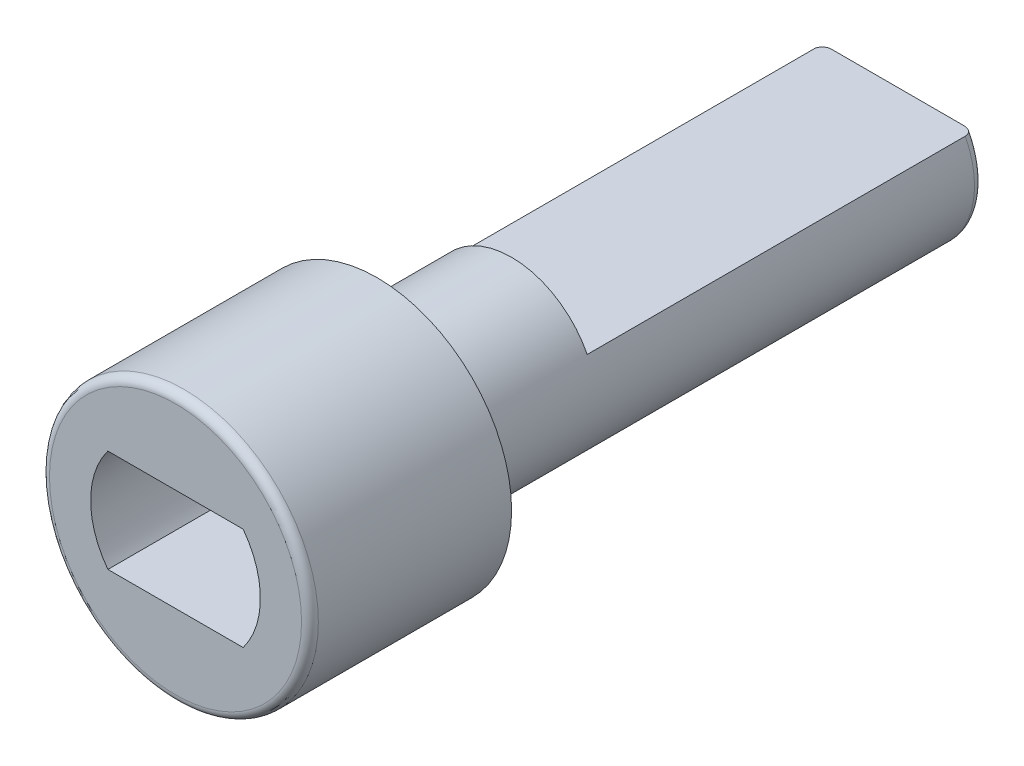
from build123d import *

# Parameters (mm, degrees)
SKETCH1_R           = 2.525
BOSS_EXTRUDE1_DEPTH = 15.5
SKETCH2_R           = 4
BOSS_EXTRUDE2_DEPTH = 6
CUT_EXTRUDE1_START  = -5
CUT_EXTRUDE1_DEPTH  = 5
FILLET2_R           = 0.25
FILLET3_R           = 0.25
CUT_EXTRUDE2_DEPTH  = 11.5


with BuildPart() as part:
    # Sketch1 → Boss-Extrude1 (new body)
    with BuildSketch(Plane.XY):
        Circle(SKETCH1_R)
    extrude(amount=BOSS_EXTRUDE1_DEPTH)

    # Sketch2 → Boss-Extrude2 (add)
    with BuildSketch(Plane.XY.offset(15.5)):
        Circle(SKETCH2_R)
    extrude(amount=BOSS_EXTRUDE2_DEPTH)

    # Sketch3 → Cut-Extrude1 (cut)
    with BuildSketch(Plane.XY.offset(21.5).offset(CUT_EXTRUDE1_START)):
        with BuildLine():
            Line((-2.01246118, 1.525), (2.01246118, 1.525))
            ThreePointArc((2.01246118, 1.525), (2.525, 0), (2.01246118, -1.525))
            Line((2.01246118, -1.525), (-2.01246118, -1.525))
            ThreePointArc((-2.01246118, -1.525), (-2.525, 0), (-2.01246118, 1.525))
        make_face()
    extrude(amount=CUT_EXTRUDE1_DEPTH, mode=Mode.SUBTRACT)

    # Fillet2
    fillet2_edges = [part.edges().sort_by_distance(p)[0] for p in [
        (-4, 0, 21.5),
    ]]
    fillet(fillet2_edges, radius=FILLET2_R)

    # Fillet3
    fillet3_edges = [part.edges().sort_by_distance(p)[0] for p in [
        (-2.525, 0, 0),
    ]]
    fillet(fillet3_edges, radius=FILLET3_R)

    # Sketch4 → Cut-Extrude2 (cut)
    with BuildSketch(Plane(origin=(0, 0, 0), x_dir=(-1, 0, 0), z_dir=(0, 0, -1))):
        with BuildLine():
            Line((-2.25, 1.145916664), (2.25, 1.145916664))
            ThreePointArc((2.25, 1.145916664), (0, 2.525), (-2.25, 1.145916664))
        make_face()
    extrude(amount=-CUT_EXTRUDE2_DEPTH, mode=Mode.SUBTRACT)


solid = part.part
